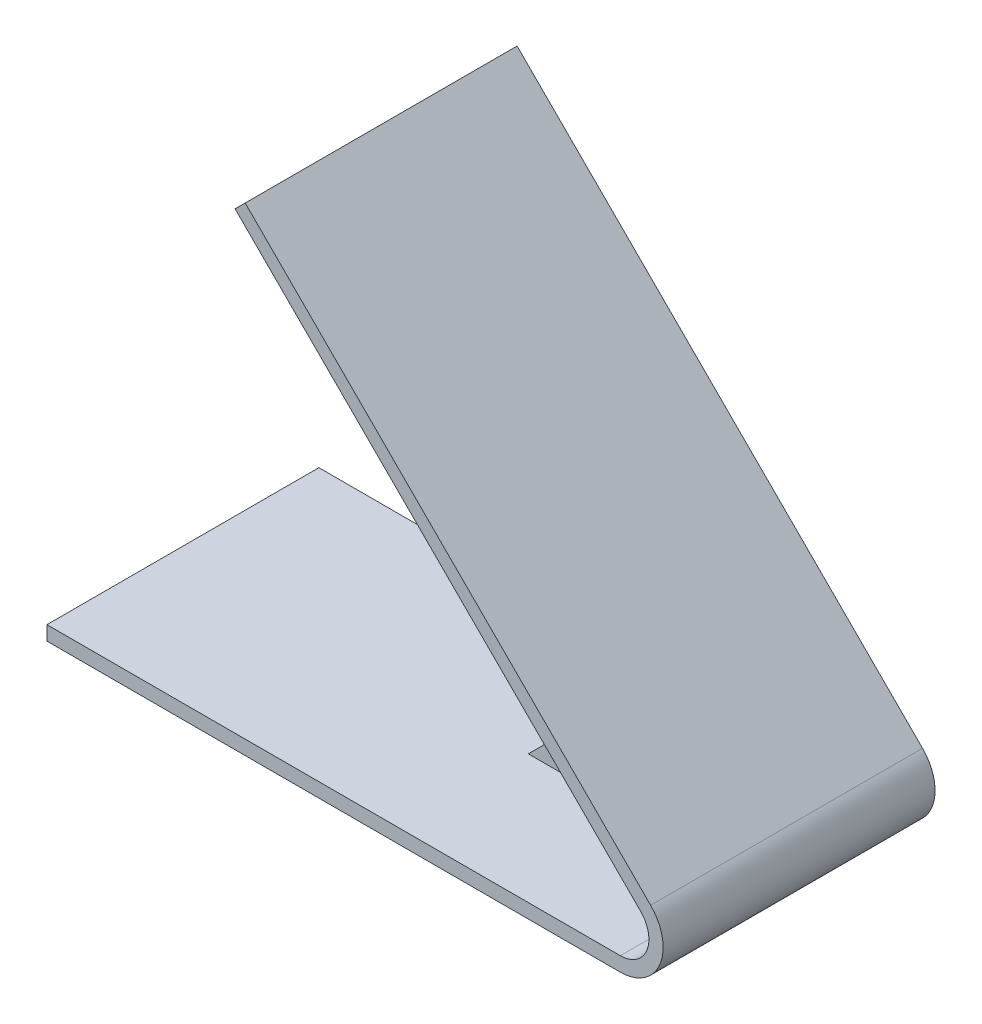
from build123d import *

# Parameters (mm, degrees)
SALIENTE_EXTRUIR1_DEPTH = 38.1
SALIENTE_EXTRUIR2_DEPTH = 1


with BuildPart() as part:
    # Croquis1 → Saliente-Extruir1 (new body)
    with BuildSketch(Plane.XY):
        with BuildLine():
            Line((-6.828427125, 6.828427125), (-63.639610307, 63.639610307))
            Line((-63.639610307, 63.639610307), (-62.225396744, 65.053823869))
            Line((-62.225396744, 65.053823869), (-5.414213562, 8.242640687))
            ThreePointArc((-5.414213562, 8.242640687), (-4.113577054, 1.703899406), (-9.656854249, -2))
            Line((-9.656854249, -2), (-90, -2))
            Line((-90, -2), (-90, 0))
            Line((-90, 0), (-9.656854249, 0))
            ThreePointArc((-9.656854249, 0), (-5.961336119, 2.469266271), (-6.828427125, 6.828427125))
        make_face()
    extrude(amount=SALIENTE_EXTRUIR1_DEPTH)

    # Croquis3 → Saliente-Extruir2 (add, symmetric)
    with BuildSketch(Plane.XY.offset(19.05)):
        Polygon((-40.597622613, 0), (-20.298811306, 20.298811306), (-6.828427125, 6.828427125), (-13.656854249, 0), align=None)
    extrude(amount=SALIENTE_EXTRUIR2_DEPTH, both=True)


solid = part.part
